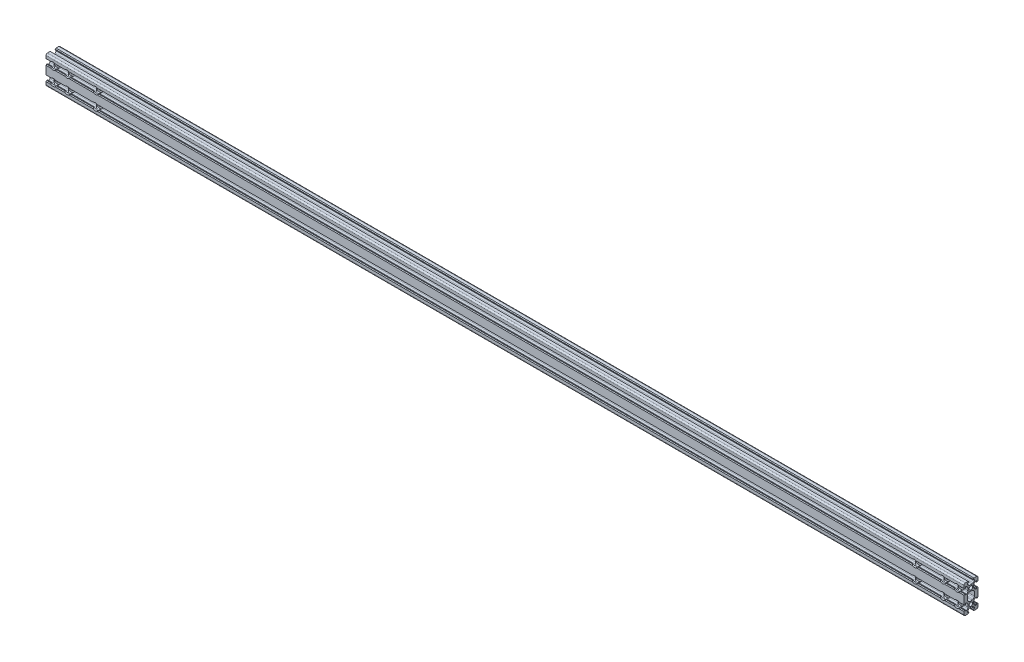
from build123d import *

# Parameters (mm, degrees)
SKETCH1_R           = 2.5
BOSS_EXTRUDE1_DEPTH = 1300
SKETCH2_R           = 2.5
CUT_EXTRUDE1_DEPTH  = 1301.769003321
CUT_EXTRUDE2_REACH  = 1302.769
SKETCH3_R           = 5


with BuildPart() as part:
    # Sketch1 → Boss-Extrude1 (new body)
    with BuildSketch(Plane(origin=(0, 0, 0), x_dir=(0, 0, -1), z_dir=(1, 0, 0))):
        with BuildLine():
            Line((6.9, 38), (5, 38))
            Line((5, 38), (5, 37.242640687))
            ThreePointArc((5, 37.242640687), (5.152240935, 36.477273822), (5.585786438, 35.828427125))
            Line((5.585786438, 35.828427125), (6.876358939, 34.537854624))
            ThreePointArc((6.876358939, 34.537854624), (7.525205636, 34.104309121), (8.290572501, 33.952068186))
            Line((8.290572501, 33.952068186), (11.709427499, 33.952068186))
            ThreePointArc((11.709427499, 33.952068186), (12.474794364, 34.104309121), (13.123641061, 34.537854624))
            Line((13.123641061, 34.537854624), (14.414213562, 35.828427125))
            ThreePointArc((14.414213562, 35.828427125), (14.847759065, 36.477273822), (15, 37.242640687))
            Line((15, 37.242640687), (15, 38))
            Line((15, 38), (13.1, 38))
            Line((13.1, 38), (13.1, 39))
            Line((13.1, 39), (14.1, 40))
            Line((14.1, 40), (18, 40))
            ThreePointArc((18, 40), (19.414213562, 39.414213562), (20, 38))
            Line((20, 38), (20, 34.1))
            Line((20, 34.1), (19, 33.1))
            Line((19, 33.1), (18, 33.1))
            Line((18, 33.1), (18, 35))
            Line((18, 35), (17.242640687, 35))
            ThreePointArc((17.242640687, 35), (16.477273822, 34.847759065), (15.828427125, 34.414213562))
            Line((15.828427125, 34.414213562), (14.537854624, 33.123641061))
            ThreePointArc((14.537854624, 33.123641061), (14.104309121, 32.474794364), (13.952068186, 31.709427499))
            Line((13.952068186, 31.709427499), (13.952068186, 28.290572501))
            ThreePointArc((13.952068186, 28.290572501), (14.104309121, 27.525205636), (14.537854624, 26.876358939))
            Line((14.537854624, 26.876358939), (15.828427125, 25.585786438))
            ThreePointArc((15.828427125, 25.585786438), (16.477273822, 25.152240935), (17.242640687, 25))
            Line((17.242640687, 25), (18, 25))
            Line((18, 25), (18, 26.9))
            Line((18, 26.9), (19, 26.9))
            Line((19, 26.9), (20, 25.9))
            Line((20, 25.9), (20, 14.1))
            Line((20, 14.1), (19, 13.1))
            Line((19, 13.1), (18, 13.1))
            Line((18, 13.1), (18, 15))
            Line((18, 15), (17.242640687, 15))
            ThreePointArc((17.242640687, 15), (16.477273822, 14.847759065), (15.828427125, 14.414213562))
            Line((15.828427125, 14.414213562), (14.537854624, 13.123641061))
            ThreePointArc((14.537854624, 13.123641061), (14.104309121, 12.474794364), (13.952068186, 11.709427499))
            Line((13.952068186, 11.709427499), (13.952068186, 8.290572501))
            ThreePointArc((13.952068186, 8.290572501), (14.104309121, 7.525205636), (14.537854624, 6.876358939))
            Line((14.537854624, 6.876358939), (15.828427125, 5.585786438))
            ThreePointArc((15.828427125, 5.585786438), (16.477273822, 5.152240935), (17.242640687, 5))
            Line((17.242640687, 5), (18, 5))
            Line((18, 5), (18, 6.9))
            Line((18, 6.9), (19, 6.9))
            Line((19, 6.9), (20, 5.9))
            Line((20, 5.9), (20, 2))
            ThreePointArc((20, 2), (19.414213562, 0.585786438), (18, 0))
            Line((18, 0), (14.1, 0))
            Line((14.1, 0), (13.1, 1))
            Line((13.1, 1), (13.1, 2))
            Line((13.1, 2), (15, 2))
            Line((15, 2), (15, 2.757359313))
            ThreePointArc((15, 2.757359313), (14.847759065, 3.522726178), (14.414213562, 4.171572875))
            Line((14.414213562, 4.171572875), (13.123641061, 5.462145376))
            ThreePointArc((13.123641061, 5.462145376), (12.474794364, 5.895690879), (11.709427499, 6.047931814))
            Line((11.709427499, 6.047931814), (8.290572501, 6.047931814))
            ThreePointArc((8.290572501, 6.047931814), (7.525205636, 5.895690879), (6.876358939, 5.462145376))
            Line((6.876358939, 5.462145376), (5.585786438, 4.171572875))
            ThreePointArc((5.585786438, 4.171572875), (5.152240935, 3.522726178), (5, 2.757359313))
            Line((5, 2.757359313), (5, 2))
            Line((5, 2), (6.9, 2))
            Line((6.9, 2), (6.9, 1))
            Line((6.9, 1), (5.9, 0))
            Line((5.9, 0), (2, 0))
            ThreePointArc((2, 0), (0.585786438, 0.585786438), (0, 2))
            Line((0, 2), (0, 5.9))
            Line((0, 5.9), (1, 6.9))
            Line((1, 6.9), (2, 6.9))
            Line((2, 6.9), (2, 5))
            Line((2, 5), (2.757359313, 5))
            ThreePointArc((2.757359313, 5), (3.522726178, 5.152240935), (4.171572875, 5.585786438))
            Line((4.171572875, 5.585786438), (5.462145376, 6.876358939))
            ThreePointArc((5.462145376, 6.876358939), (5.895690879, 7.525205636), (6.047931814, 8.290572501))
            Line((6.047931814, 8.290572501), (6.047931814, 11.709427499))
            ThreePointArc((6.047931814, 11.709427499), (5.895690879, 12.474794364), (5.462145376, 13.123641061))
            Line((5.462145376, 13.123641061), (4.171572875, 14.414213562))
            ThreePointArc((4.171572875, 14.414213562), (3.522726178, 14.847759065), (2.757359313, 15))
            Line((2.757359313, 15), (2, 15))
            Line((2, 15), (2, 13.1))
            Line((2, 13.1), (1, 13.1))
            Line((1, 13.1), (0, 14.1))
            Line((0, 14.1), (0, 25.9))
            Line((0, 25.9), (1, 26.9))
            Line((1, 26.9), (2, 26.9))
            Line((2, 26.9), (2, 25))
            Line((2, 25), (2.757359313, 25))
            ThreePointArc((2.757359313, 25), (3.522726178, 25.152240935), (4.171572875, 25.585786438))
            Line((4.171572875, 25.585786438), (5.462145376, 26.876358939))
            ThreePointArc((5.462145376, 26.876358939), (5.895690879, 27.525205636), (6.047931814, 28.290572501))
            Line((6.047931814, 28.290572501), (6.047931814, 31.709427499))
            ThreePointArc((6.047931814, 31.709427499), (5.895690879, 32.474794364), (5.462145376, 33.123641061))
            Line((5.462145376, 33.123641061), (4.171572875, 34.414213562))
            ThreePointArc((4.171572875, 34.414213562), (3.522726178, 34.847759065), (2.757359313, 35))
            Line((2.757359313, 35), (2, 35))
            Line((2, 35), (2, 33.1))
            Line((2, 33.1), (1, 33.1))
            Line((1, 33.1), (0, 34.1))
            Line((0, 34.1), (0, 38))
            ThreePointArc((0, 38), (0.585786438, 39.414213562), (2, 40))
            Line((2, 40), (5.9, 40))
            Line((5.9, 40), (6.9, 39))
            Line((6.9, 39), (6.9, 38))
        make_face()
        with Locations((10, 10)):
            Circle(SKETCH1_R, mode=Mode.SUBTRACT)
        with Locations((10, 30)):
            Circle(SKETCH1_R, mode=Mode.SUBTRACT)
        with BuildLine():
            Line((14.414213562, 15.828427125), (13.123641061, 14.537854624))
            ThreePointArc((13.123641061, 14.537854624), (12.474794364, 14.104309121), (11.709427499, 13.952068186))
            Line((11.709427499, 13.952068186), (8.290572501, 13.952068186))
            ThreePointArc((8.290572501, 13.952068186), (7.525205636, 14.104309121), (6.876358939, 14.537854624))
            Line((6.876358939, 14.537854624), (5.585786438, 15.828427125))
            ThreePointArc((5.585786438, 15.828427125), (5.152240935, 16.477273822), (5, 17.242640687))
            Line((5, 17.242640687), (5, 22.757359313))
            ThreePointArc((5, 22.757359313), (5.152240935, 23.522726178), (5.585786438, 24.171572875))
            Line((5.585786438, 24.171572875), (6.876358939, 25.462145376))
            ThreePointArc((6.876358939, 25.462145376), (7.525205636, 25.895690879), (8.290572501, 26.047931814))
            Line((8.290572501, 26.047931814), (11.709427499, 26.047931814))
            ThreePointArc((11.709427499, 26.047931814), (12.474794364, 25.895690879), (13.123641061, 25.462145376))
            Line((13.123641061, 25.462145376), (14.414213562, 24.171572875))
            ThreePointArc((14.414213562, 24.171572875), (14.847759065, 23.522726178), (15, 22.757359313))
            Line((15, 22.757359313), (15, 17.242640687))
            ThreePointArc((15, 17.242640687), (14.847759065, 16.477273822), (14.414213562, 15.828427125))
        make_face(mode=Mode.SUBTRACT)
    extrude(amount=BOSS_EXTRUDE1_DEPTH)

    # Sketch2 → Cut-Extrude1 (cut, through all)
    with BuildSketch(Plane.XY):
        with Locations(Location((1290, 30, 0), (0, 0, 316.860970278))):
            Circle(SKETCH2_R)
        with Locations(Location((1270, 30, 0), (0, 0, 316.860970278))):
            Circle(SKETCH2_R)
        with Locations(Location((1230, 30, 0), (0, 0, 316.860970278))):
            Circle(SKETCH2_R)
        with Locations(Location((1290, 10, 0), (0, 0, 316.860970278))):
            Circle(SKETCH2_R)
        with Locations(Location((1270, 10, 0), (0, 0, 316.860970278))):
            Circle(SKETCH2_R)
        with Locations(Location((1230, 10, 0), (0, 0, 316.860970278))):
            Circle(SKETCH2_R)
        with Locations(Location((70, 10, 0), (0, 0, 316.860970278))):
            Circle(SKETCH2_R)
        with Locations(Location((30, 10, 0), (0, 0, 316.860970278))):
            Circle(SKETCH2_R)
        with Locations(Location((10, 10, 0), (0, 0, 316.860970278))):
            Circle(SKETCH2_R)
        with Locations(Location((70, 30, 0), (0, 0, 316.860970278))):
            Circle(SKETCH2_R)
        with Locations(Location((30, 30, 0), (0, 0, 316.860970278))):
            Circle(SKETCH2_R)
        with Locations(Location((10, 30, 0), (0, 0, 316.860970278))):
            Circle(SKETCH2_R)
    extrude(amount=-CUT_EXTRUDE1_DEPTH, mode=Mode.SUBTRACT)

    # Cut-Extrude2: up to this face of the body (flat: up to its plane)
    cut_extrude2_end = Plane(part.part.faces().sort_by_distance((1296.141762122, 30, -6.047931814))[0])
    # Sketch3 → Cut-Extrude2 (cut, up to the picked face)
    with BuildSketch(Plane.XY, mode=Mode.PRIVATE) as cut_extrude2_sk1:
        with Locations((1290, 30)):
            Circle(SKETCH3_R)
    cut_extrude2_tool1 = split(extrude(cut_extrude2_sk1.sketch, amount=-CUT_EXTRUDE2_REACH, mode=Mode.PRIVATE), bisect_by=cut_extrude2_end, keep=Keep.BOTH, mode=Mode.PRIVATE)
    # Sketch3 → Cut-Extrude2 (cut, up to the picked face)
    with BuildSketch(Plane.XY, mode=Mode.PRIVATE) as cut_extrude2_sk2:
        with Locations((1270, 30)):
            Circle(SKETCH3_R)
    cut_extrude2_tool2 = split(extrude(cut_extrude2_sk2.sketch, amount=-CUT_EXTRUDE2_REACH, mode=Mode.PRIVATE), bisect_by=cut_extrude2_end, keep=Keep.BOTH, mode=Mode.PRIVATE)
    # Sketch3 → Cut-Extrude2 (cut, up to the picked face)
    with BuildSketch(Plane.XY, mode=Mode.PRIVATE) as cut_extrude2_sk3:
        with Locations((1230, 30)):
            Circle(SKETCH3_R)
    cut_extrude2_tool3 = split(extrude(cut_extrude2_sk3.sketch, amount=-CUT_EXTRUDE2_REACH, mode=Mode.PRIVATE), bisect_by=cut_extrude2_end, keep=Keep.BOTH, mode=Mode.PRIVATE)
    # Sketch3 → Cut-Extrude2 (cut, up to the picked face)
    with BuildSketch(Plane.XY, mode=Mode.PRIVATE) as cut_extrude2_sk4:
        with Locations((1230, 10)):
            Circle(SKETCH3_R)
    cut_extrude2_tool4 = split(extrude(cut_extrude2_sk4.sketch, amount=-CUT_EXTRUDE2_REACH, mode=Mode.PRIVATE), bisect_by=cut_extrude2_end, keep=Keep.BOTH, mode=Mode.PRIVATE)
    # Sketch3 → Cut-Extrude2 (cut, up to the picked face)
    with BuildSketch(Plane.XY, mode=Mode.PRIVATE) as cut_extrude2_sk5:
        with Locations((1270, 10)):
            Circle(SKETCH3_R)
    cut_extrude2_tool5 = split(extrude(cut_extrude2_sk5.sketch, amount=-CUT_EXTRUDE2_REACH, mode=Mode.PRIVATE), bisect_by=cut_extrude2_end, keep=Keep.BOTH, mode=Mode.PRIVATE)
    # Sketch3 → Cut-Extrude2 (cut, up to the picked face)
    with BuildSketch(Plane.XY, mode=Mode.PRIVATE) as cut_extrude2_sk6:
        with Locations((1290, 10)):
            Circle(SKETCH3_R)
    cut_extrude2_tool6 = split(extrude(cut_extrude2_sk6.sketch, amount=-CUT_EXTRUDE2_REACH, mode=Mode.PRIVATE), bisect_by=cut_extrude2_end, keep=Keep.BOTH, mode=Mode.PRIVATE)
    # Sketch3 → Cut-Extrude2 (cut, up to the picked face)
    with BuildSketch(Plane.XY, mode=Mode.PRIVATE) as cut_extrude2_sk7:
        with Locations((10, 10)):
            Circle(SKETCH3_R)
    cut_extrude2_tool7 = split(extrude(cut_extrude2_sk7.sketch, amount=-CUT_EXTRUDE2_REACH, mode=Mode.PRIVATE), bisect_by=cut_extrude2_end, keep=Keep.BOTH, mode=Mode.PRIVATE)
    # Sketch3 → Cut-Extrude2 (cut, up to the picked face)
    with BuildSketch(Plane.XY, mode=Mode.PRIVATE) as cut_extrude2_sk8:
        with Locations((30, 10)):
            Circle(SKETCH3_R)
    cut_extrude2_tool8 = split(extrude(cut_extrude2_sk8.sketch, amount=-CUT_EXTRUDE2_REACH, mode=Mode.PRIVATE), bisect_by=cut_extrude2_end, keep=Keep.BOTH, mode=Mode.PRIVATE)
    # Sketch3 → Cut-Extrude2 (cut, up to the picked face)
    with BuildSketch(Plane.XY, mode=Mode.PRIVATE) as cut_extrude2_sk9:
        with Locations((70, 10)):
            Circle(SKETCH3_R)
    cut_extrude2_tool9 = split(extrude(cut_extrude2_sk9.sketch, amount=-CUT_EXTRUDE2_REACH, mode=Mode.PRIVATE), bisect_by=cut_extrude2_end, keep=Keep.BOTH, mode=Mode.PRIVATE)
    # Sketch3 → Cut-Extrude2 (cut, up to the picked face)
    with BuildSketch(Plane.XY, mode=Mode.PRIVATE) as cut_extrude2_sk10:
        with Locations((70, 30)):
            Circle(SKETCH3_R)
    cut_extrude2_tool10 = split(extrude(cut_extrude2_sk10.sketch, amount=-CUT_EXTRUDE2_REACH, mode=Mode.PRIVATE), bisect_by=cut_extrude2_end, keep=Keep.BOTH, mode=Mode.PRIVATE)
    # Sketch3 → Cut-Extrude2 (cut, up to the picked face)
    with BuildSketch(Plane.XY, mode=Mode.PRIVATE) as cut_extrude2_sk11:
        with Locations((30, 30)):
            Circle(SKETCH3_R)
    cut_extrude2_tool11 = split(extrude(cut_extrude2_sk11.sketch, amount=-CUT_EXTRUDE2_REACH, mode=Mode.PRIVATE), bisect_by=cut_extrude2_end, keep=Keep.BOTH, mode=Mode.PRIVATE)
    # Sketch3 → Cut-Extrude2 (cut, up to the picked face)
    with BuildSketch(Plane.XY, mode=Mode.PRIVATE) as cut_extrude2_sk12:
        with Locations((10, 30)):
            Circle(SKETCH3_R)
    cut_extrude2_tool12 = split(extrude(cut_extrude2_sk12.sketch, amount=-CUT_EXTRUDE2_REACH, mode=Mode.PRIVATE), bisect_by=cut_extrude2_end, keep=Keep.BOTH, mode=Mode.PRIVATE)
    add(cut_extrude2_tool1.solids().sort_by(Axis((1290, 30, 0), (0, 0, -1)))[0], mode=Mode.SUBTRACT)
    add(cut_extrude2_tool2.solids().sort_by(Axis((1270, 30, 0), (0, 0, -1)))[0], mode=Mode.SUBTRACT)
    add(cut_extrude2_tool3.solids().sort_by(Axis((1230, 30, 0), (0, 0, -1)))[0], mode=Mode.SUBTRACT)
    add(cut_extrude2_tool4.solids().sort_by(Axis((1230, 10, 0), (0, 0, -1)))[0], mode=Mode.SUBTRACT)
    add(cut_extrude2_tool5.solids().sort_by(Axis((1270, 10, 0), (0, 0, -1)))[0], mode=Mode.SUBTRACT)
    add(cut_extrude2_tool6.solids().sort_by(Axis((1290, 10, 0), (0, 0, -1)))[0], mode=Mode.SUBTRACT)
    add(cut_extrude2_tool7.solids().sort_by(Axis((10, 10, 0), (0, 0, -1)))[0], mode=Mode.SUBTRACT)
    add(cut_extrude2_tool8.solids().sort_by(Axis((30, 10, 0), (0, 0, -1)))[0], mode=Mode.SUBTRACT)
    add(cut_extrude2_tool9.solids().sort_by(Axis((70, 10, 0), (0, 0, -1)))[0], mode=Mode.SUBTRACT)
    add(cut_extrude2_tool10.solids().sort_by(Axis((70, 30, 0), (0, 0, -1)))[0], mode=Mode.SUBTRACT)
    add(cut_extrude2_tool11.solids().sort_by(Axis((30, 30, 0), (0, 0, -1)))[0], mode=Mode.SUBTRACT)
    add(cut_extrude2_tool12.solids().sort_by(Axis((10, 30, 0), (0, 0, -1)))[0], mode=Mode.SUBTRACT)


solid = part.part
